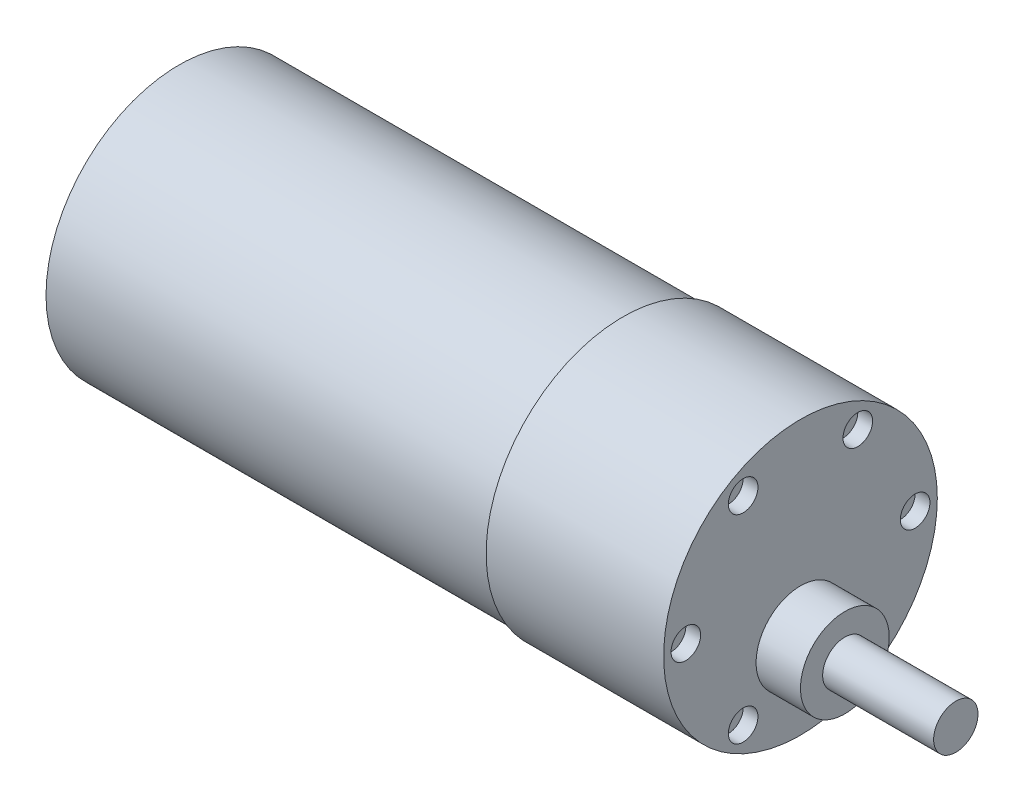
from build123d import *

# Parameters (mm, degrees)
SKETCH1_R           = 18.5
BOSS_EXTRUDE1_DEPTH = 24
SKETCH2_R           = 18
BOSS_EXTRUDE2_DEPTH = 60
SKETCH3_R           = 6
BOSS_EXTRUDE3_DEPTH = 6
SKETCH4_R           = 3
BOSS_EXTRUDE4_DEPTH = 15
SKETCH5_R           = 2
CUT_EXTRUDE1_DEPTH  = 2


with BuildPart() as part:
    # Sketch1 → Boss-Extrude1 (new body)
    with BuildSketch(Plane(origin=(0, 0, 0), x_dir=(0, 0, -1), z_dir=(1, 0, 0))):
        Circle(SKETCH1_R)
    extrude(amount=-BOSS_EXTRUDE1_DEPTH)

    # Sketch2 → Boss-Extrude2 (add)
    with BuildSketch(Plane.ZY.offset(24)):
        Circle(SKETCH2_R)
    extrude(amount=BOSS_EXTRUDE2_DEPTH)

    # Sketch3 → Boss-Extrude3 (add)
    with BuildSketch(Plane(origin=(0, 0, 0), x_dir=(0, 0, -1), z_dir=(1, 0, 0))):
        with Locations((0, -7)):
            Circle(SKETCH3_R)
    extrude(amount=BOSS_EXTRUDE3_DEPTH)

    # Sketch4 → Boss-Extrude4 (add)
    with BuildSketch(Plane(origin=(6, 0, 0), x_dir=(0, 0, -1), z_dir=(1, 0, 0))):
        with Locations((0, -7)):
            Circle(SKETCH4_R)
    extrude(amount=BOSS_EXTRUDE4_DEPTH)

    # Sketch5 → Cut-Extrude1 (cut)
    with BuildSketch(Plane(origin=(0, 0, 0), x_dir=(0, 0, -1), z_dir=(1, 0, 0))):
        with Locations((-15.5, 0)):
            Circle(SKETCH5_R)
        with Locations((-7.75, 13.423393759)):
            Circle(SKETCH5_R)
        with Locations((7.75, 13.423393759)):
            Circle(SKETCH5_R)
        with Locations((15.5, 0)):
            Circle(SKETCH5_R)
        with Locations((7.75, -13.423393759)):
            Circle(SKETCH5_R)
        with Locations((-7.75, -13.423393759)):
            Circle(SKETCH5_R)
    extrude(amount=-CUT_EXTRUDE1_DEPTH, mode=Mode.SUBTRACT)


solid = part.part
